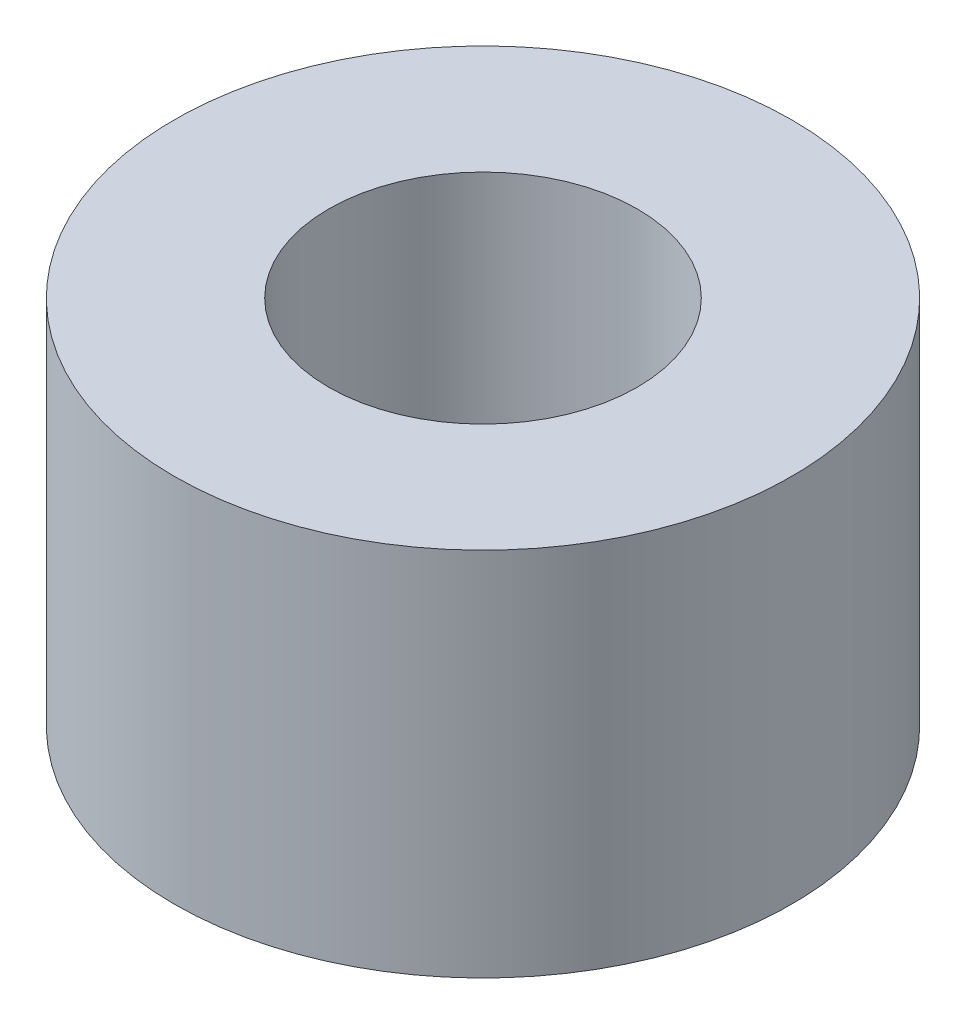
from build123d import *

# Parameters (mm, degrees)
SKETCH1_R           = 5
SKETCH1_R_2         = 2.5
BOSS_EXTRUDE1_DEPTH = 6


with BuildPart() as part:
    # Sketch1 → Boss-Extrude1 (new body)
    with BuildSketch(Plane(origin=(0, 0, 0), x_dir=(1, 0, 0), z_dir=(0, 1, 0))):
        with Locations(Location((0, 0, 0), (0, 0, 270))):
            Circle(SKETCH1_R)
        with Locations(Location((0, 0, 0), (0, 0, 270))):
            Circle(SKETCH1_R_2, mode=Mode.SUBTRACT)
    extrude(amount=BOSS_EXTRUDE1_DEPTH)


solid = part.part
